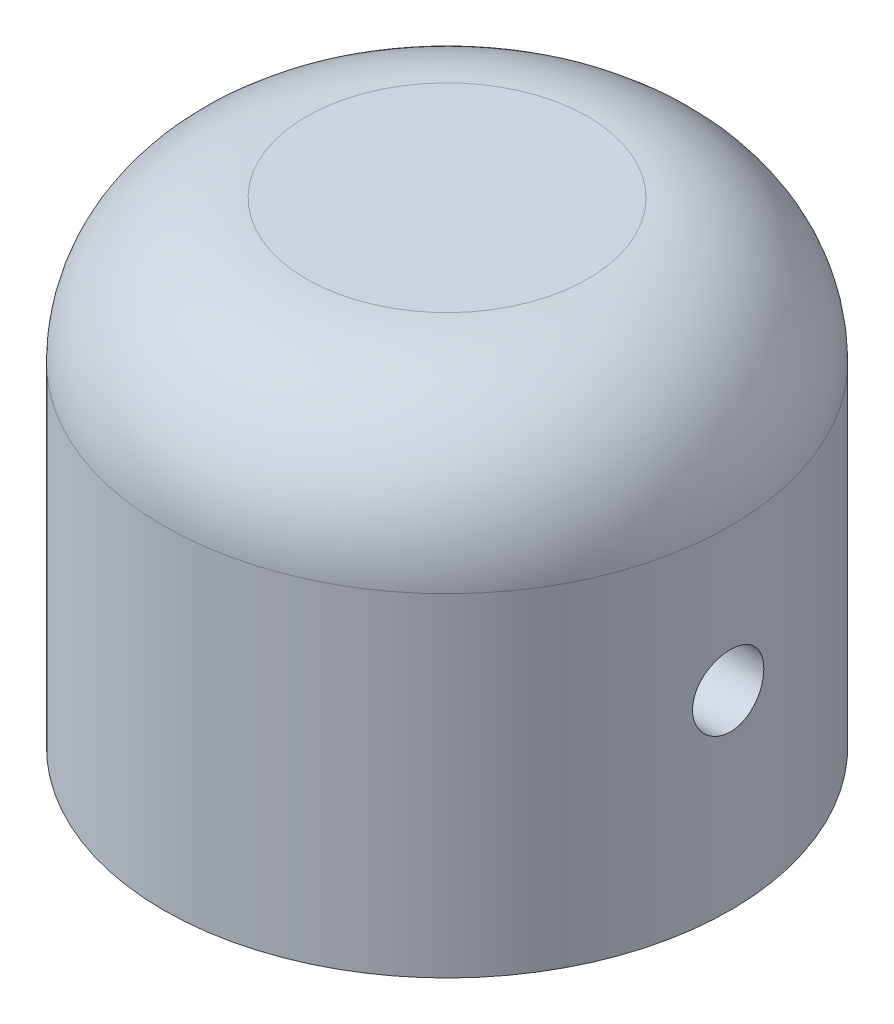
from build123d import *

# Parameters (mm, degrees)
SKETCH1_R           = 6.2865
BOSS_EXTRUDE1_DEPTH = 15.875
SKETCH2_R           = 9.4615
BOSS_EXTRUDE2_DEPTH = 15.875
CUT_EXTRUDE1_DEPTH  = 12.7
FILLET1_R           = 4.7625
SKETCH4_R           = 1.1905
CUT_EXTRUDE2_DEPTH  = 24.398129359


with BuildPart() as part:
    # Sketch1 → Boss-Extrude1 (new body)
    with BuildSketch(Plane(origin=(0, 0, 0), x_dir=(1, 0, 0), z_dir=(0, 1, 0))):
        with Locations(Location((0, 0, 0), (0, 0, 270))):
            Circle(SKETCH1_R)
    extrude(amount=BOSS_EXTRUDE1_DEPTH)

    # Sketch2 → Boss-Extrude2 (add)
    with BuildSketch(Plane(origin=(0, 0, 0), x_dir=(1, 0, 0), z_dir=(0, 1, 0))):
        with Locations(Location((0, 0, 0), (0, 0, 270))):
            Circle(SKETCH2_R)
    extrude(amount=BOSS_EXTRUDE2_DEPTH)

    # Sketch3 → Cut-Extrude1 (cut)
    with BuildSketch(Plane.XZ):
        with BuildLine():
            Line((4.889, -4.248435947), (4.889, 4.248435947))
            ThreePointArc((4.889, 4.248435947), (-6.477, 0), (4.889, -4.248435947))
        make_face()
    extrude(amount=-CUT_EXTRUDE1_DEPTH, mode=Mode.SUBTRACT)

    # Fillet1
    fillet1_edges = [part.edges().sort_by_distance(p)[0] for p in [
        (0, 15.875, -9.4615),
    ]]
    fillet(fillet1_edges, radius=FILLET1_R)

    # Sketch4 → Cut-Extrude2 (cut, through all)
    with BuildSketch(Plane.ZY.offset(-4.889)):
        with Locations((0, 6.35)):
            Circle(SKETCH4_R)
    extrude(amount=-CUT_EXTRUDE2_DEPTH, mode=Mode.SUBTRACT)


solid = part.part
